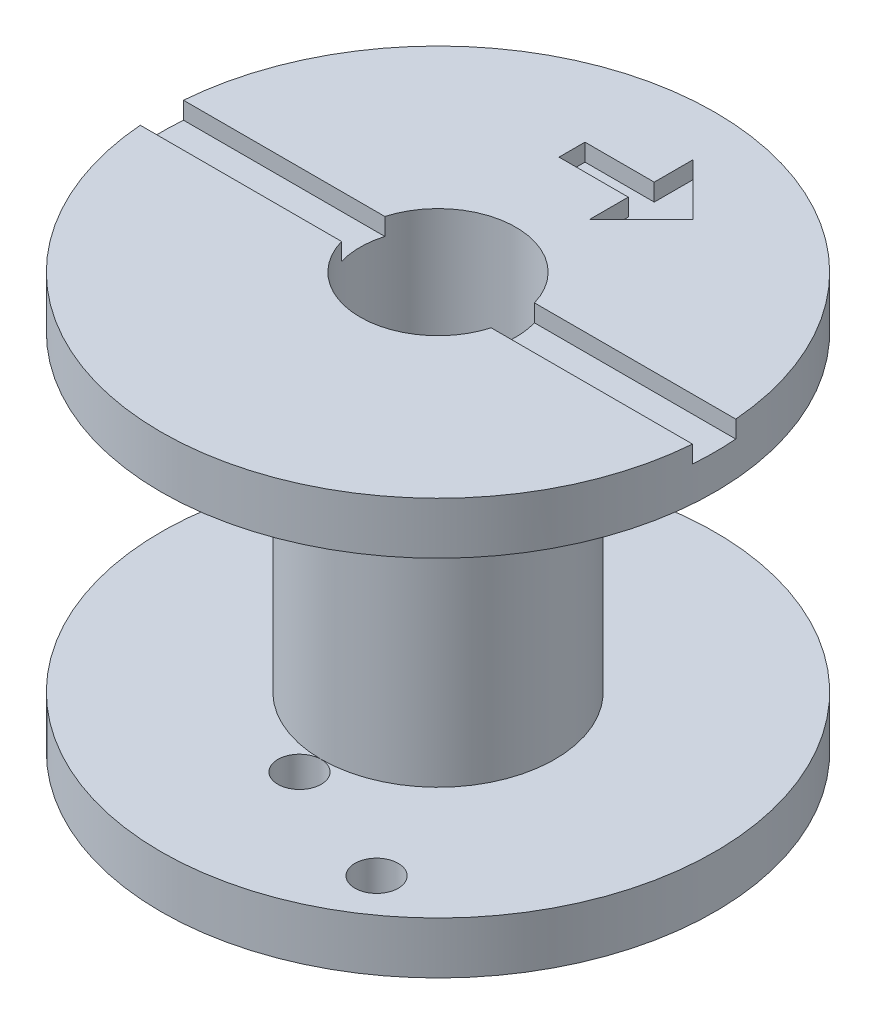
from build123d import *

# Parameters (mm, degrees)
SKETCH3_R               = 1.25
CUT_EXTRUDE1_DEPTH      = 9
CUT_EXTRUDE2_DEPTH      = 1
CUT_EXTRUDE3_DEPTH      = 15
CUT_EXTRUDE3_DEPTH_BACK = 1
CUT_EXTRUDE3_START      = -40
SKETCH5_W               = 42.611665196
SKETCH5_H               = 2.5


with BuildPart() as part:
    # Sketch2 → Revolve1 (revolve)
    with BuildSketch(Plane(origin=(0, 0, 0), x_dir=(0, 0, -1), z_dir=(1, 0, 0))):
        Polygon((-16, 12), (-16, 9), (-6.75, 9), (-6.75, -9), (-16, -9), (-16, -12), (-6.5, -12), (-6.5, -14), (-4.5, -14), (-4.5, -12), (-4.5, 12), align=None)
    revolve(axis=Axis((0, 15.5, 0), (0, -1, 0)))

    # Sketch3 → Cut-Extrude1 (cut)
    with BuildSketch(Plane.XZ.offset(12)):
        with Locations(Location((0, 8, 0), (0, 0, 270))):
            Circle(SKETCH3_R)
        with Locations(Location((7.425425002, 10.973858189, 0), (0, 0, 270))):
            Circle(SKETCH3_R)
    extrude(amount=-CUT_EXTRUDE1_DEPTH, mode=Mode.SUBTRACT)

    # Sketch4 → Cut-Extrude2 (cut)
    with BuildSketch(Plane(origin=(0, 12, 0), x_dir=(1, 0, 0), z_dir=(0, 1, 0))):
        Polygon((-2.25827734, 10.75), (1.74172266, 10.75), (1.74172266, 13.000000233), (4.74172266, 10), (1.74172266, 7.000000233), (1.74172266, 9.25), (-2.25827734, 9.25), align=None)
    extrude(amount=-CUT_EXTRUDE2_DEPTH, mode=Mode.SUBTRACT)

    # Sketch5 → Cut-Extrude3 (cut, two sides: drawn at the far end of the back side and taken through both)
    with BuildSketch(Plane.XZ.offset(14).offset(CUT_EXTRUDE3_START - CUT_EXTRUDE3_DEPTH_BACK)):
        Rectangle(SKETCH5_W, SKETCH5_H)
    extrude(amount=CUT_EXTRUDE3_DEPTH + CUT_EXTRUDE3_DEPTH_BACK, mode=Mode.SUBTRACT)


solid = part.part
